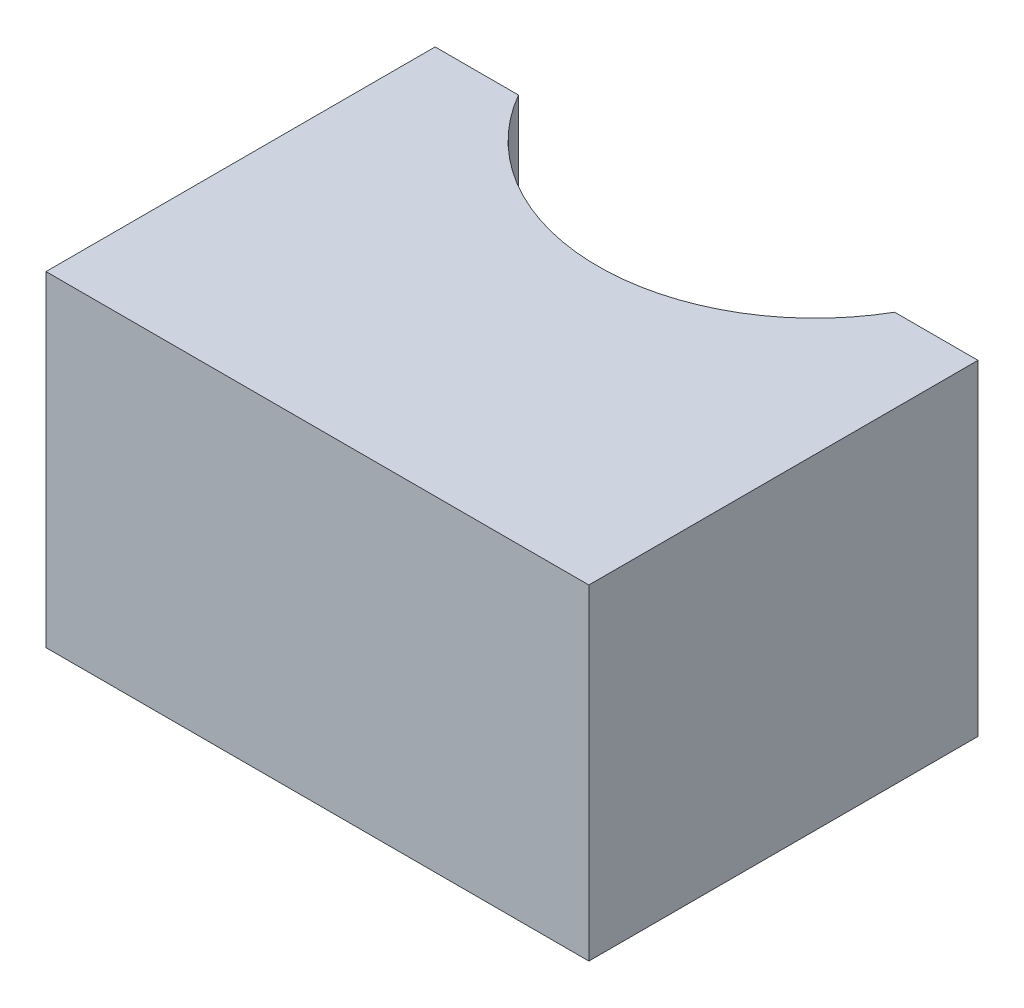
from build123d import *

# Parameters (mm, degrees)
SKETCH1_W           = 31.75
SKETCH1_H           = 19.05
BOSS_EXTRUDE1_DEPTH = 22.7584
SKETCH2_R           = 12.7
CUT_EXTRUDE1_DEPTH  = 34.658028694


with BuildPart() as part:
    # Sketch1 → Boss-Extrude1 (new body)
    with BuildSketch(Plane.XY):
        Rectangle(SKETCH1_W, SKETCH1_H)
    extrude(amount=BOSS_EXTRUDE1_DEPTH)

    # Sketch2 → Cut-Extrude1 (cut, through all)
    with BuildSketch(Plane(origin=(0, 9.525, 0), x_dir=(1, 0, 0), z_dir=(0, 1, 0))):
        with Locations((0, 6.35)):
            Circle(SKETCH2_R)
    extrude(amount=-CUT_EXTRUDE1_DEPTH, mode=Mode.SUBTRACT)


solid = part.part
